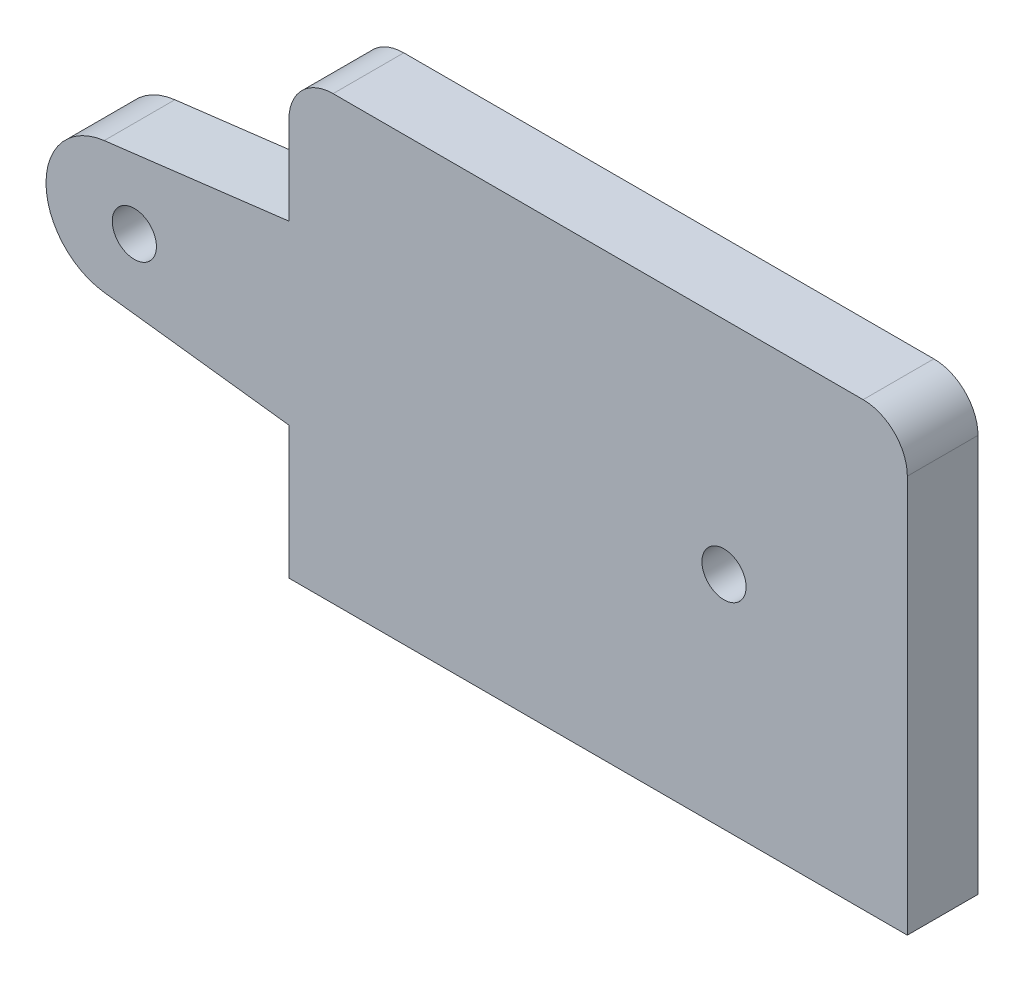
from build123d import *

# Parameters (mm, degrees)
SKETCH1_R           = 2.5
BOSS_EXTRUDE3_DEPTH = 8


with BuildPart() as part:
    # Sketch1 → Boss-Extrude3 (new body)
    # profile 1 of 3: a face of its own
    with BuildSketch(Plane.XY):
        with BuildLine():
            ThreePointArc((30, 25), (33.535533906, 23.535533906), (35, 20))
            Line((35, 20), (35, -25))
            Line((35, -25), (-35, -25))
            Line((-35, -25), (-35, 20))
            ThreePointArc((-35, 20), (-33.535533906, 23.535533906), (-30, 25))
            Line((-30, 25), (30, 25))
        make_face()
        with Locations((14.25, 0)):
            Circle(SKETCH1_R, mode=Mode.SUBTRACT)
    # profile 2 of 3: a face of its own
    with BuildSketch(Plane.XY):
        with BuildLine():
            Line((-35, -10), (-35, 10))
            Line((-35, 10), (-55.909806165, 7.44461233))
            ThreePointArc((-55.909806165, 7.44461233), (-50.028760026, 5.615761134), (-47.5, 0))
            ThreePointArc((-47.5, 0), (-50.028760026, -5.615761134), (-55.909806165, -7.44461233))
            Line((-55.909806165, -7.44461233), (-35, -10))
        make_face()
    # profile 3 of 3: a face of its own
    with BuildSketch(Plane.XY):
        with BuildLine():
            ThreePointArc((-47.5, 0), (-50.028760026, 5.615761134), (-55.909806165, 7.44461233))
            ThreePointArc((-55.909806165, 7.44461233), (-62.5, 0), (-55.909806165, -7.44461233))
            ThreePointArc((-55.909806165, -7.44461233), (-50.028760026, -5.615761134), (-47.5, 0))
        make_face()
        with Locations((-52.5, 0)):
            Circle(SKETCH1_R, mode=Mode.SUBTRACT)
    extrude(amount=BOSS_EXTRUDE3_DEPTH)


solid = part.part
